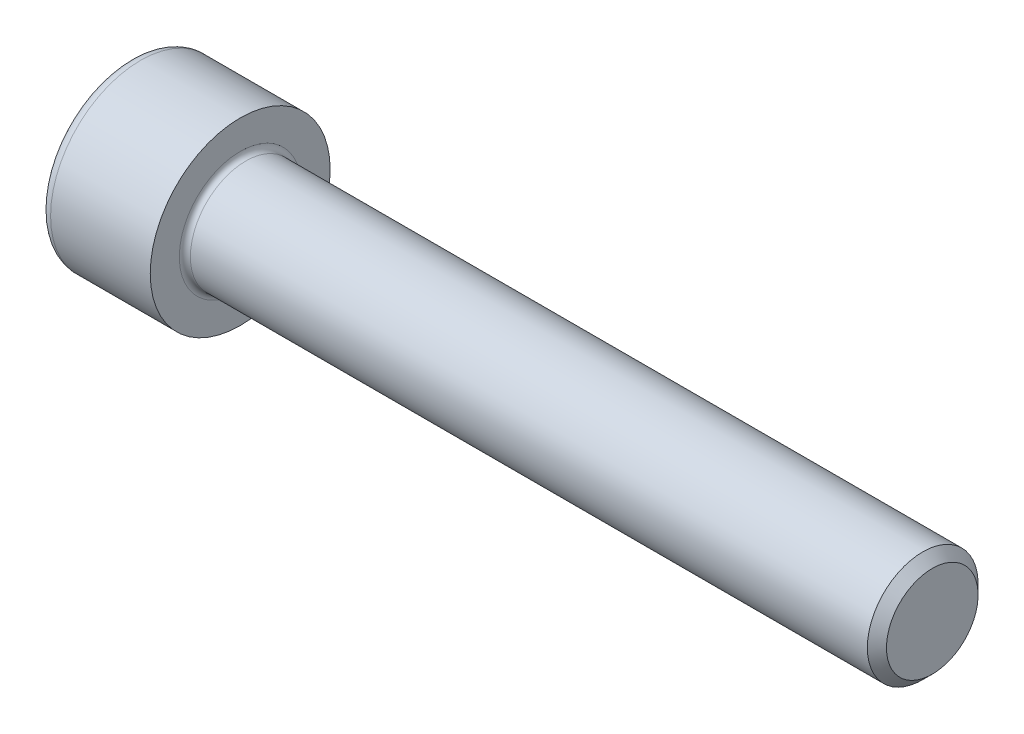
from build123d import *

# Parameters (mm, degrees)
FILLET1_R   = 0.4
FILLET2_R   = 0.8
HEX_2_DEPTH = 4


with BuildPart() as part:
    # BodySke → Base-Revolve (revolve)
    with BuildSketch(Plane.XY, mode=Mode.PRIVATE) as base_revolve_sk:
        Polygon((0, 0), (0, 6.5), (8, 6.5), (8, 4), (57.3095, 4), (58, 3.3095), (58, 0), align=None)
    revolve(base_revolve_sk.sketch.rotate(Axis((-31.75, 0, 0), (1, 0, 0)), 90), axis=Axis((-31.75, 0, 0), (1, 0, 0)))

    # Fillet1
    fillet1_edges = [part.edges().sort_by_distance(p)[0] for p in [
        (8, 0, -4),
    ]]
    fillet(fillet1_edges, radius=FILLET1_R)

    # Fillet2
    fillet2_edges = [part.edges().sort_by_distance(p)[0] for p in [
        (0, 0, -6.5),
    ]]
    fillet(fillet2_edges, radius=FILLET2_R)

    # Sketch2 → Hex-PreBroach (revolve, cut)
    with BuildSketch(Plane.XY, mode=Mode.PRIVATE) as hex_prebroach_sk:
        Polygon((0, 3.01), (4, 3.01), (5.73782431, 0), (0, 0), align=None)
    revolve(hex_prebroach_sk.sketch.rotate(Axis((0, 0, 0), (1, 0, 0)), 90), axis=Axis((0, 0, 0), (1, 0, 0)), mode=Mode.SUBTRACT)

    # Sketch3 → Hex 2 (cut)
    with BuildSketch(Plane(origin=(0, 0, 0), x_dir=(0, 0.500000000000001, 0.866025403784438), z_dir=(-1, 0, 0))):
        Polygon((1.73782431, 3.01), (-1.73782431, 3.01), (-3.475648621, 0), (-1.73782431, -3.01), (1.73782431, -3.01), (3.475648621, 0), align=None)
    extrude(amount=-HEX_2_DEPTH, mode=Mode.SUBTRACT)


solid = part.part
